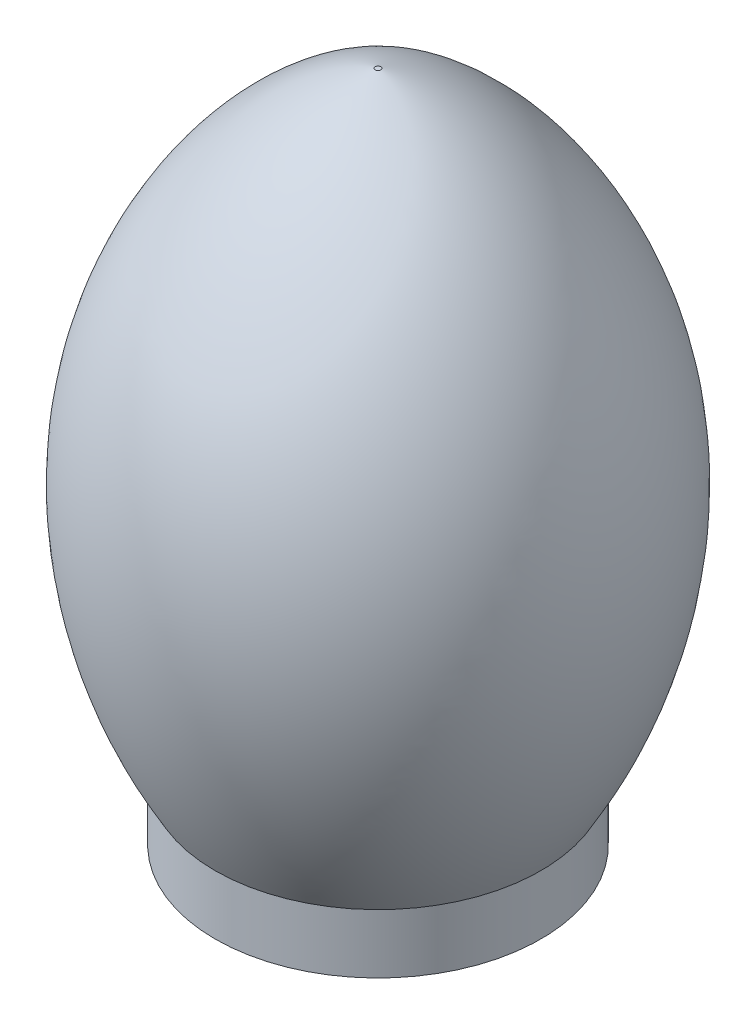
from build123d import *

# Parameters (mm, degrees)
SKETCH6_R           = 46.767915722
BOSS_EXTRUDE1_DEPTH = 17


with BuildPart() as part:
    # Sketch3 → Revolve2 (revolve)
    with BuildSketch(Plane(origin=(0, -67.031201242, 0), x_dir=(0, 0, -1), z_dir=(1, 0, 0))):
        with BuildLine():
            add(Edge.make_bspline(
                [(-1.733589523, -89.409016069), (-1.99736032, -88.951339009), (-2.521661549, -88.043804263), (-3.596186919, -86.166179777), (-5.408532911, -82.86731887), (-8.831443894, -76.152994285), (-13.091508451, -66.289684347), (-17.156029835, -54.093129241), (-21.104496752, -37.467318384), (-23.152235184, -16.215102001), (-20.985796534, 5.089174087), (-16.513939147, 21.795152409), (-10.129409488, 38.180304288), (-0.917912269, 53.66729944), (10.807602914, 66.97885035), (20.795056297, 75.55535071), (30.060858253, 81.25039371), (37.988800039, 84.755808518), (42.134962805, 86.133235661), (44.231994393, 86.715275771)],
                knots=[-0.008619991, -0.008619991, -0.008619991, -0.008619991, -0.000740147, 0.007139697, 0.022899384, 0.054418759, 0.117457508, 0.180496257, 0.243535007, 0.369612506, 0.495690005, 0.558728754, 0.621767503, 0.747845002, 0.810883752, 0.873922501, 0.936961251, 0.968480625, 1, 1, 1, 1], degree=3))
            Line((44.231994393, 86.715275771), (45.034326199, 86.715275771))
            Line((45.034326199, 86.715275771), (45.034326199, 83.824555502))
            add(Edge.make_bspline(
                [(0, -86.409016069), (-19.811004259, -52.034315357), (-30.028997158, 18.566820254), (19.010829705, 76.601622459), (45.034326199, 83.824555502)],
                knots=[0, 0, 0, 0, 0.591830554, 1, 1, 1, 1], degree=3))
            Line((0, -86.409016069), (45.034326199, -86.409016069))
            Line((45.034326199, -86.409016069), (45.034326199, -89.409016069))
            Line((45.034326199, -89.409016069), (-1.733589523, -89.409016069))
        make_face()
    revolve(axis=Axis((0, 16.79335426, -45.034326199), (0, -1, 0)))

    # Sketch6 → Boss-Extrude1 (add)
    with BuildSketch(Plane.XZ.offset(156.440217311)):
        with Locations(Location((0, -45.034326199, 0), (0, 0, 270))):
            Circle(SKETCH6_R)
    extrude(amount=BOSS_EXTRUDE1_DEPTH)


solid = part.part
